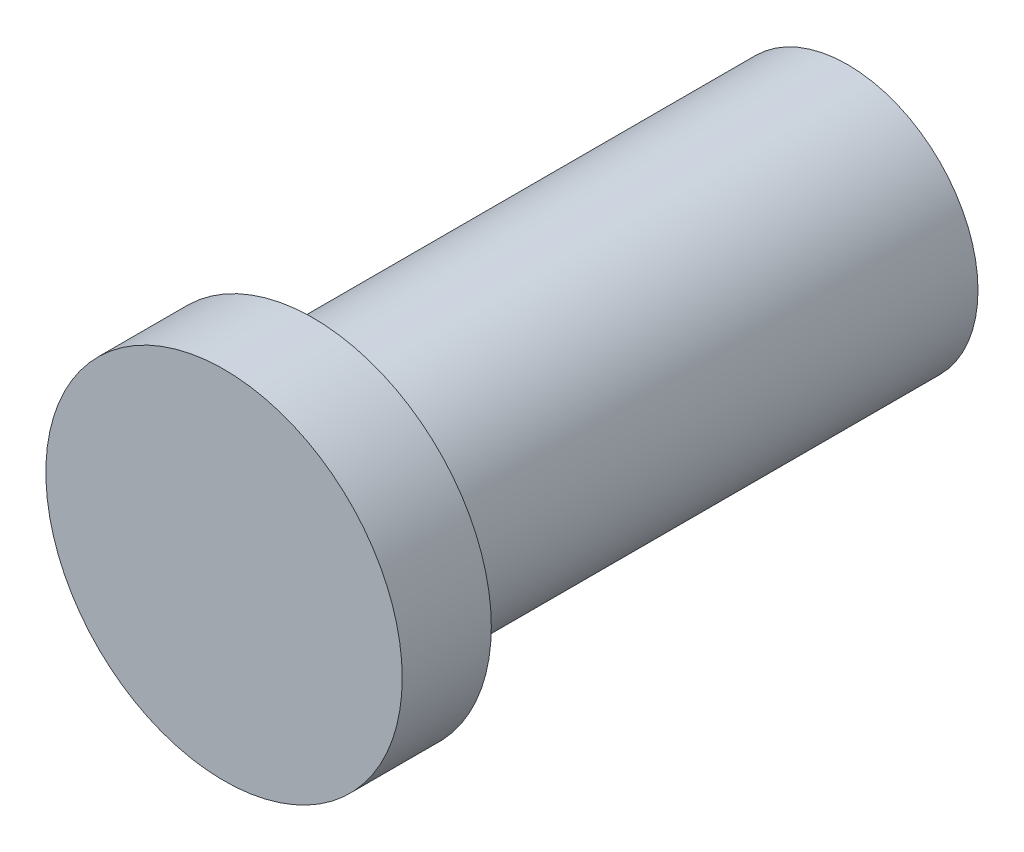
from build123d import *

# Parameters (mm, degrees)
ESQUISSE1_R        = 2.925
BOSS_EXTRU_1_DEPTH = 12
ESQUISSE2_R        = 4
BOSS_EXTRU_2_DEPTH = 2


with BuildPart() as part:
    # Esquisse1 → Boss.-Extru.1 (new body)
    with BuildSketch(Plane.XY):
        with Locations((-7.597189856, 3.918976898)):
            Circle(ESQUISSE1_R)
    extrude(amount=BOSS_EXTRU_1_DEPTH)

    # Esquisse2 → Boss.-Extru.2 (add)
    with BuildSketch(Plane.XY.offset(12)):
        with Locations((-7.597189856, 3.918976898)):
            Circle(ESQUISSE2_R)
    extrude(amount=BOSS_EXTRU_2_DEPTH)


solid = part.part
